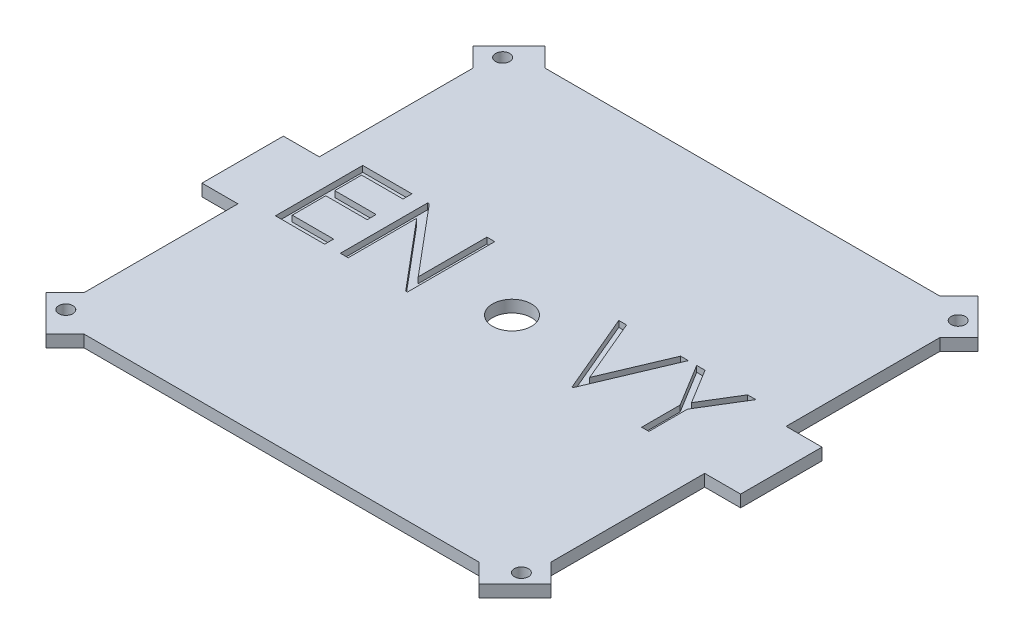
from build123d import *

# Parameters (mm, degrees)
SKETCH1_R           = 4.1275
BOSS_EXTRUDE1_DEPTH = 2.54
SKETCH2_R           = 1.5
CUT_EXTRUDE1_DEPTH  = 267.081941915
CUT_EXTRUDE2_DEPTH  = 1.27
SKETCH1_5_W         = 30.48
SKETCH1_5_H         = 7.62
BOSS_EXTRUDE2_DEPTH = 3.556
FILLET1_R           = 2.54


with BuildPart() as part:
    # Sketch1 → Boss-Extrude1 (new body)
    with BuildSketch(Plane(origin=(0, 0, 0), x_dir=(1, 0, 0), z_dir=(0, 1, 0))):
        Polygon((239.739404703, 17.423809937), (235.698289449, 13.382694682), (151.878289449, 13.382694682), (147.837174194, 17.423809937), (140.217174194, 9.803809937), (144.258289449, 5.762694682), (144.258289449, -26.876305318), (136.638289449, -26.876305318), (136.638289449, -44.148305318), (144.258289449, -44.148305318), (144.258289449, -76.787305318), (140.217174194, -80.828420572), (147.837174194, -88.448420572), (151.878289449, -84.407305318), (235.698289449, -84.407305318), (239.739404703, -88.448420572), (247.359404703, -80.828420572), (243.318289449, -76.787305318), (243.318289449, -44.148305318), (250.938289449, -44.148305318), (250.938289449, -26.876305318), (243.318289449, -26.876305318), (243.318289449, 5.762694682), (247.359404703, 9.803809937), align=None)
        with Locations((193.788289449, -35.512305318)):
            Circle(SKETCH1_R, mode=Mode.SUBTRACT)
    extrude(amount=BOSS_EXTRUDE1_DEPTH)

    # Sketch2 → Cut-Extrude1 (cut, through all)
    with BuildSketch(Plane(origin=(0, 2.54, 0), x_dir=(1, 0, 0), z_dir=(0, 1, 0))):
        with Locations((145.448426066, 10.832301944)):
            Circle(SKETCH2_R)
        with Locations((242.128152831, 10.832301944)):
            Circle(SKETCH2_R)
        with Locations((242.128152831, -81.856912579)):
            Circle(SKETCH2_R)
        with Locations((145.448426066, -81.856912579)):
            Circle(SKETCH2_R)
    extrude(amount=-CUT_EXTRUDE1_DEPTH, mode=Mode.SUBTRACT)

    # Sketch3 → Cut-Extrude2 (cut)
    with BuildSketch(Plane(origin=(0, 2.54, 0), x_dir=(1, 0, 0), z_dir=(0, 1, 0))):
        Polygon((150.442755261, -23.843216639), (160.890404833, -23.843216639), (160.890404833, -25.742789289), (152.104881329, -25.742789289), (152.104881329, -31.441507237), (160.890404833, -31.441507237), (160.890404833, -33.341079887), (152.104881329, -33.341079887), (152.104881329, -40.464477323), (160.890404833, -40.464477323), (160.890404833, -42.364049972), (150.442755261, -42.364049972), align=None)
        Polygon((164.21465697, -42.364049972), (164.21465697, -23.843216639), (164.563406636, -23.843216639), (176.799325773, -38.420210663), (176.799325773, -23.843216639), (178.461451842, -23.843216639), (178.461451842, -42.364049972), (178.083021353, -42.364049972), (165.876783038, -27.820446874), (165.876783038, -42.364049972), align=None)
        Polygon((206.100233893, -25.166133306), (207.753879726, -25.166133306), (213.486518615, -38.719138948), (219.219157504, -25.166133306), (220.872803338, -25.166133306), (213.596761671, -42.364049972), (213.37627556, -42.364049972), align=None)
        Polygon((222.636692226, -25.166133306), (224.404026211, -25.166133306), (228.923991489, -32.555863124), (233.437066575, -25.166133306), (235.20440056, -25.166133306), (229.692247782, -34.188838384), (229.692247782, -42.364049972), (228.148845004, -42.364049972), (228.148845004, -34.188838384), align=None)
    extrude(amount=-CUT_EXTRUDE2_DEPTH, mode=Mode.SUBTRACT)

    # Sketch1<5> → Boss-Extrude2 (add)
    with BuildSketch(Plane(origin=(0, 0, 0), x_dir=(1, 0, 0), z_dir=(0, 1, 0))):
        with Locations((228.078289449, -35.512305318)):
            Rectangle(SKETCH1_5_W, SKETCH1_5_H)
        with Locations((159.498289449, -35.512305318)):
            Rectangle(SKETCH1_5_W, SKETCH1_5_H)
    extrude(amount=-BOSS_EXTRUDE2_DEPTH)

    # Fillet1
    fillet1_edges = [part.edges().sort_by_distance(p)[0] for p in [
        (228.078289449, -3.556, 39.322305318),
        (228.078289449, -3.556, 31.702305318),
        (159.498289449, -3.556, 31.702305318),
        (159.498289449, -3.556, 39.322305318),
    ]]
    fillet(fillet1_edges, radius=FILLET1_R)


solid = part.part
